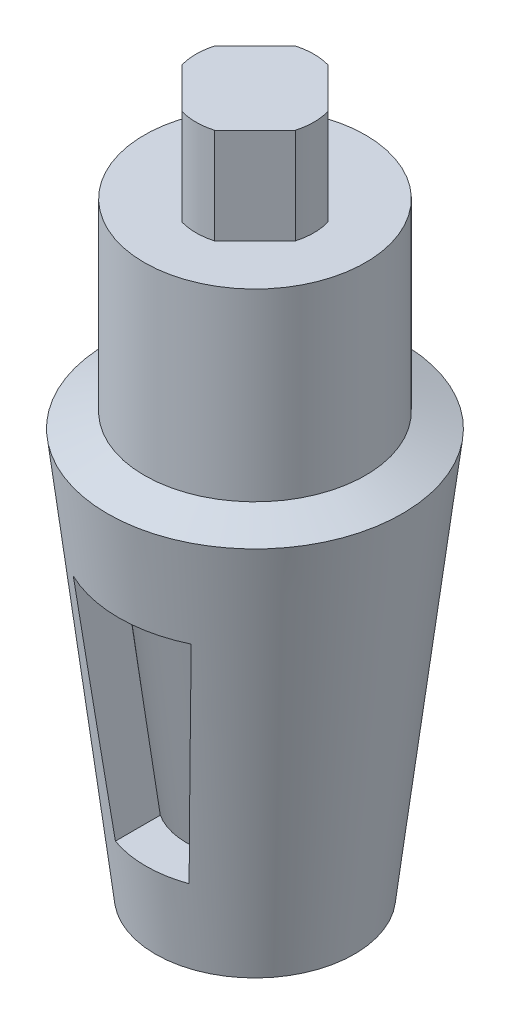
from build123d import *

# Parameters (mm, degrees)
CUT_EXTRUDE1_DEPTH      = 199.242276016
CUT_EXTRUDE1_DEPTH_BACK = 199.242276016
SKETCH4_OUTSIDE_W       = 126.226
SKETCH4_OUTSIDE_H       = 126.226
CUT_EXTRUDE2_DEPTH      = 26


with BuildPart() as part:
    # Sketch1 → Revolve1 (revolve)
    with BuildSketch(Plane.XY, mode=Mode.PRIVATE) as revolve1_sk:
        with BuildLine():
            ThreePointArc((27.345454545, 96), (25.880988451, 99.535533906), (22.345454545, 101))
            Line((22.345454545, 101), (20, 101))
            Line((20, 101), (20, 157))
            Line((20, 157), (0, 157))
            Line((0, 157), (0, 190))
            Line((0, 190), (16, 190))
            Line((16, 190), (16, 164))
            Line((16, 164), (30, 164))
            Line((30, 164), (30, 114))
            Line((30, 114), (40, 110))
            Line((40, 110), (27, 0))
            Line((27, 0), (16, 0))
            Line((16, 0), (27.345454545, 96))
        make_face()
    revolve(revolve1_sk.sketch.rotate(Axis((0, 293.194202694, 0), (0, -1, 0)), 90), axis=Axis((0, 293.194202694, 0), (0, -1, 0)))

    # Sketch3 → Cut-Extrude1 (cut, two sides: drawn at the far end of the back side and taken through both)
    with BuildSketch(Plane.XY.offset(-CUT_EXTRUDE1_DEPTH_BACK)):
        Polygon((16, 84), (-16, 84), (-10, 22), (10, 22), align=None)
    extrude(amount=CUT_EXTRUDE1_DEPTH + CUT_EXTRUDE1_DEPTH_BACK, mode=Mode.SUBTRACT)

    # Sketch4 outside → Cut-Extrude2 (cut)
    with BuildSketch(Plane(origin=(0, 190, 0), x_dir=(1, 0, 0), z_dir=(0, 1, 0))):
        Rectangle(SKETCH4_OUTSIDE_W, SKETCH4_OUTSIDE_H)
        Polygon((3.798989873, 16), (16, 3.798989873), (16, -3.798989873), (3.798989873, -16), (-3.798989873, -16), (-16, -3.798989873), (-16, 3.798989873), (-3.798989873, 16), align=None, mode=Mode.SUBTRACT)
    extrude(amount=-CUT_EXTRUDE2_DEPTH, mode=Mode.SUBTRACT)


solid = part.part
